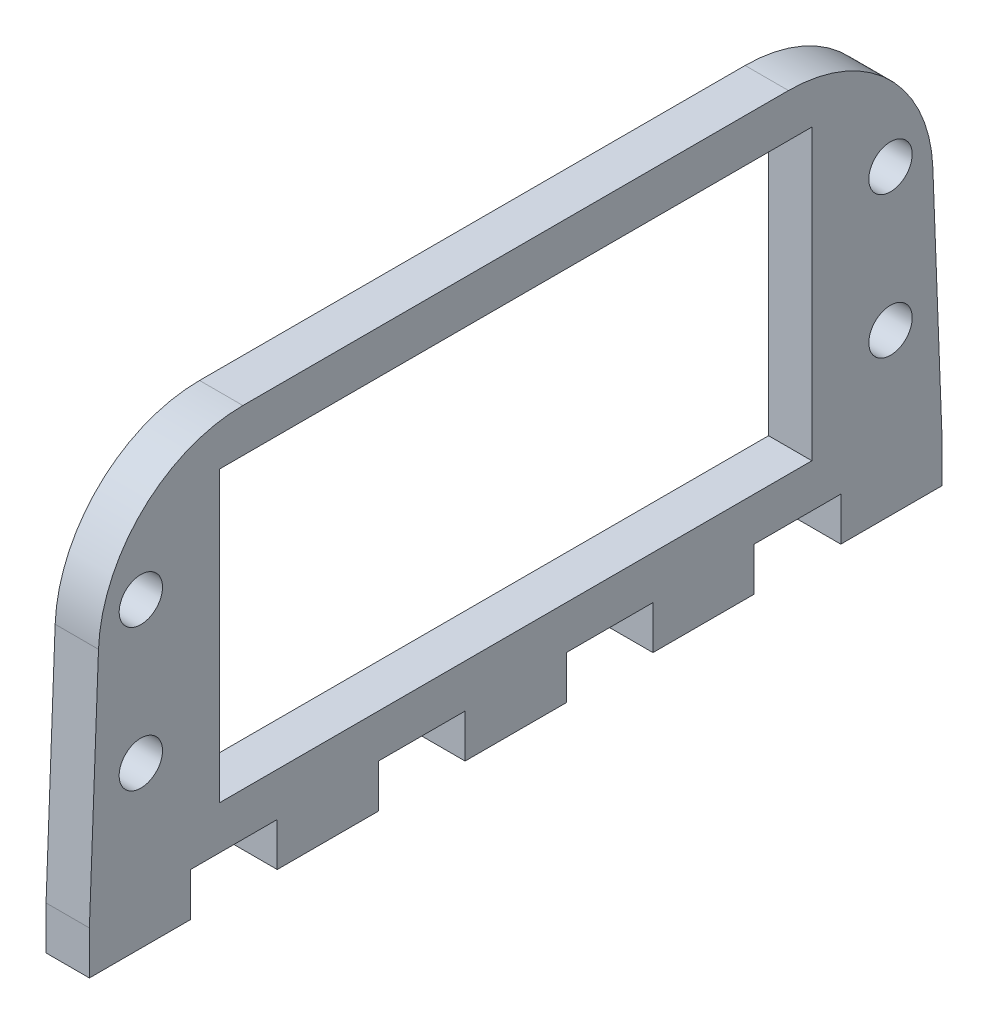
from build123d import *

# Parameters (mm, degrees)
SKETCH1_R           = 1.5
SKETCH1_W           = 41
SKETCH1_H           = 20
BOSS_EXTRUDE1_DEPTH = 3
FILLET1_R           = 10


with BuildPart() as part:
    # Sketch1 → Boss-Extrude1 (new body)
    with BuildSketch(Plane(origin=(0, 0, 0), x_dir=(0, 0, -1), z_dir=(1, 0, 0))):
        Polygon((-33, 0), (-32, 26), (25, 26), (26, 0), (26, -3), (19, -3), (19, 0), (13, 0), (13, -3), (6, -3), (6, 0), (0, 0), (0, -3), (-7, -3), (-7, 0), (-13, 0), (-13, -3), (-20, -3), (-20, 0), (-26, 0), (-26, -3), (-33, -3), align=None)
        with Locations((22.44, 17.9)):
            Circle(SKETCH1_R, mode=Mode.SUBTRACT)
        with Locations(Location((22.44, 8.1, 0), (0, 0, 180))):
            Circle(SKETCH1_R, mode=Mode.SUBTRACT)
        with Locations(Location((-29.44, 17.9, 0), (0, 0, 180))):
            Circle(SKETCH1_R, mode=Mode.SUBTRACT)
        with Locations((-29.44, 8.1)):
            Circle(SKETCH1_R, mode=Mode.SUBTRACT)
        with Locations((-3.5, 13)):
            Rectangle(SKETCH1_W, SKETCH1_H, mode=Mode.SUBTRACT)
    extrude(amount=BOSS_EXTRUDE1_DEPTH)

    # Fillet1
    fillet1_edges = [part.edges().sort_by_distance(p)[0] for p in [
        (1.5, 26, 32),
        (1.5, 26, -25),
    ]]
    fillet(fillet1_edges, radius=FILLET1_R)


solid = part.part
